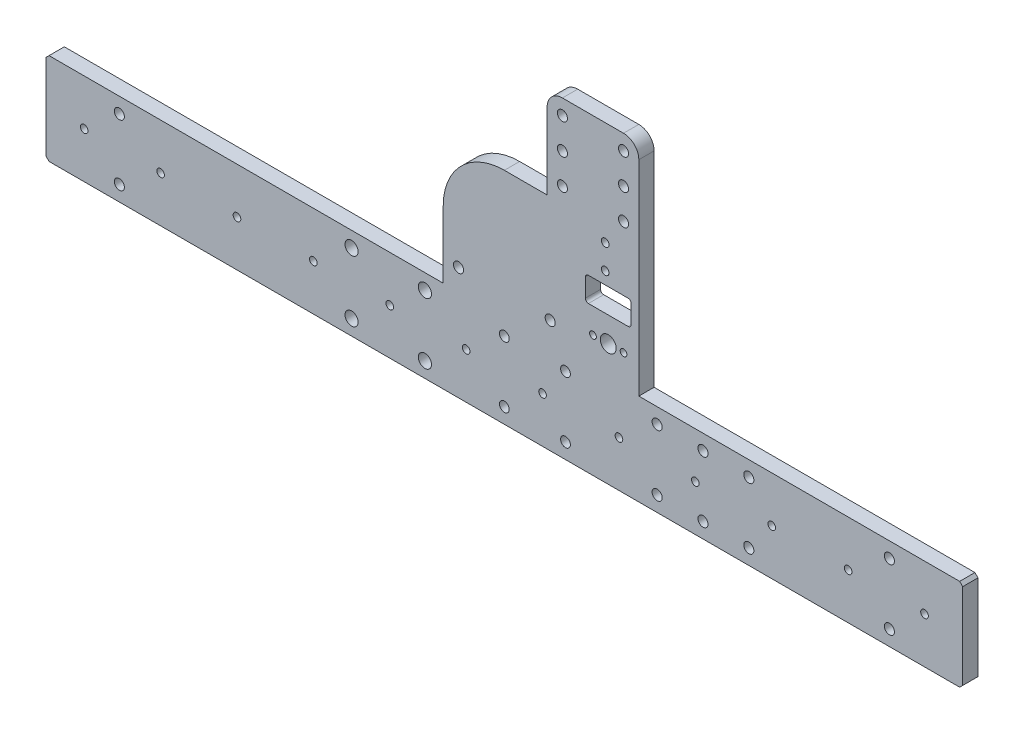
from build123d import *

# Parameters (mm, degrees)
SKETCH_1_W                  = 300
SKETCH_1_H                  = 30
EXTRUDE_1_DEPTH             = 5
CHAMFER_1_SIZE              = 1
HOLE_WIZARD_M3_1_D          = 3.2
M3X0_5_1_D                  = 2.5
M4X0_7_1_D                  = 3.3
M4X0_7_2_D                  = 3.3
PATTERN_LINEAR_1_COUNT      = 6
PATTERN_LINEAR_1_PITCH      = 25
PATTERN_LINEAR_1_COL_COUNT  = 7
PATTERN_LINEAR_1_COL_PITCH  = 25
EXTRUDE_3_DEPTH             = 5
SKETCH_13_R                 = 2.6
CUT_EXTRUDE_2_DEPTH         = 161.542829177
HOLE_WIZARD_M2_1_D          = 2.2
M4X0_7_3_D                  = 3.3
HOLE_WIZARD_M4_1_D          = 4.3
M3X0_5_2_D                  = 2.5
CUT_EXTRUDE_3_DEPTH         = 161.542829177
CUT_EXTRUDE_3_DEPTH_BACK    = 161.542829177
SKETCH_25_W                 = 15
SKETCH_25_H                 = 8
FILLET_1_R                  = 1
SKETCH_26_W                 = 30
SKETCH_26_H                 = 5
EXTRUDE_4_DEPTH             = 30
SKETCH_27_R                 = 1.65
CUT_EXTRUDE_4_DEPTH         = 174.476223155
PATTERN_LINEAR_2_COUNT      = 2
PATTERN_LINEAR_2_PITCH      = 20
PATTERN_LINEAR_2_COUNT_DIR2 = 3
PATTERN_LINEAR_2_PITCH_DIR2 = 10
FILLET_2_R                  = 5


with BuildPart() as part:
    # 草圖1 → 填料-伸長1 (new body)
    with BuildSketch(Plane.XY):
        Rectangle(SKETCH_1_W, SKETCH_1_H)
    extrude(amount=EXTRUDE_1_DEPTH)

    # 導角1
    chamfer_1_edges = [part.edges().sort_by_distance(p)[0] for p in [
        (150, -15, 2.5),
        (-150, -15, 2.5),
        (-150, 15, 2.5),
        (150, 15, 2.5),
    ]]
    chamfer(chamfer_1_edges, length=CHAMFER_1_SIZE)

    # M3 餘隙孔1 (through all)
    with Locations(Plane.XY.offset(5)):
        with Locations((20, -10), (20, 10), (0, -10), (0, 10)):
            Hole(HOLE_WIZARD_M3_1_D / 2)

    # M3x0.5 螺紋孔1 (through all)
    with Locations(Plane.XY.offset(5)):
        with Locations((-12.5, 0)):
            m3x0_5_1 = Hole(M3X0_5_1_D / 2)

    # M4x0.7 螺紋孔1 (through all)
    with Locations(Plane.XY.offset(5)):
        with Locations((80, 10), (50, -10), (50, 10), (80, -10), (65, 10), (65, -10)):
            Hole(M4X0_7_1_D / 2)

    # M4x0.7 螺紋孔2 (through all)
    with Locations(Plane.XY.offset(5)):
        with Locations((-126, 10), (-126, -10)):
            m4x0_7_2 = Hole(M4X0_7_2_D / 2)

    # 直線複製排列1: M3x0.5 螺紋孔1 ×6
    with Locations(*[(-i * PATTERN_LINEAR_1_PITCH, 0, 0) for i in range(1, PATTERN_LINEAR_1_COUNT)]):
        add(m3x0_5_1, mode=Mode.SUBTRACT)

    # 直線複製排列1 col: M3x0.5 螺紋孔1 ×7
    with Locations(*[(i * PATTERN_LINEAR_1_COL_PITCH, 0, 0) for i in range(1, PATTERN_LINEAR_1_COL_COUNT)]):
        add(m3x0_5_1, mode=Mode.SUBTRACT)

    # 鏡射1: M4x0.7 螺紋孔2 across plane
    add(m4x0_7_2.mirror(Plane(origin=(0, 0, 0), x_dir=(0, 0, 1), z_dir=(1, 0, 0))), mode=Mode.SUBTRACT)

    # 草圖16 → 填料-伸長3 (add, through all)
    with BuildSketch(Plane.XY):
        with BuildLine():
            Line((-20, 15), (44, 15))
            Line((44, 15), (44, 57))
            Line((44, 57), (0, 57))
            ThreePointArc((0, 57), (-14.142135624, 51.142135624), (-20, 37))
            Line((-20, 37), (-20, 15))
        make_face()
    extrude(amount=EXTRUDE_3_DEPTH)

    # 草圖13 → 除料-伸長2 (cut, through all)
    with BuildSketch(Plane.XY):
        with Locations(Location((34, 24.8, 0), (0, 0, 180))):
            Circle(SKETCH_13_R)
    extrude(amount=CUT_EXTRUDE_2_DEPTH, mode=Mode.SUBTRACT)

    # M2 餘隙孔1 (through all)
    with Locations(Plane.XY.offset(5)):
        with Locations((29, 24.8), (39, 24.8)):
            Hole(HOLE_WIZARD_M2_1_D / 2)

    # M4x0.7 螺紋孔3 (through all)
    with Locations(Plane.XY.offset(5)):
        with Locations((15, 22), (-15, 22)):
            Hole(M4X0_7_3_D / 2)

    # M4 餘隙孔1 (through all)
    with Locations(Plane.XY.offset(5)):
        with Locations((-26, -10), (-26, 10), (-50, -10), (-50, 10)):
            Hole(HOLE_WIZARD_M4_1_D / 2)

    # M3x0.5 螺紋孔2 (through all)
    with Locations(Plane.XY.offset(5)):
        with Locations((33, 53), (33, 45)):
            Hole(M3X0_5_2_D / 2)

    # 草圖25 → 除料-伸長3 (cut, two sides: drawn at the far end of the back side and taken through both)
    with BuildSketch(Plane.XY.offset(5).offset(-CUT_EXTRUDE_3_DEPTH_BACK)):
        with Locations((34, 37)):
            Rectangle(SKETCH_25_W, SKETCH_25_H)
    extrude(amount=CUT_EXTRUDE_3_DEPTH + CUT_EXTRUDE_3_DEPTH_BACK, mode=Mode.SUBTRACT)

    # 圓角1
    fillet_1_edges = [part.edges().sort_by_distance(p)[0] for p in [
        (41.5, 41, 2.5),
        (41.5, 33, 2.5),
        (26.5, 33, 2.5),
        (26.5, 41, 2.5),
    ]]
    fillet(fillet_1_edges, radius=FILLET_1_R)

    # 草圖26 → 填料-伸長4 (add)
    with BuildSketch(Plane(origin=(0, 57, 0), x_dir=(1, 0, 0), z_dir=(0, 1, 0))):
        with Locations((29, -2.5)):
            Rectangle(SKETCH_26_W, SKETCH_26_H)
    extrude(amount=EXTRUDE_4_DEPTH)

    # 草圖27 → 除料-伸長4 (cut, through all)
    with BuildSketch(Plane.XY.offset(5)):
        with Locations((19, 82)):
            Circle(SKETCH_27_R)
    cut_extrude_4 = extrude(amount=-CUT_EXTRUDE_4_DEPTH, mode=Mode.SUBTRACT)

    # 直線複製排列2: Cut-Extrude 4 2 × 3
    with Locations(*[(i * PATTERN_LINEAR_2_PITCH, -j * PATTERN_LINEAR_2_PITCH_DIR2, 0) for i in range(PATTERN_LINEAR_2_COUNT) for j in range(PATTERN_LINEAR_2_COUNT_DIR2) if (i, j) != (0, 0)]):
        add(cut_extrude_4, mode=Mode.SUBTRACT)

    # 圓角2
    fillet_2_edges = [part.edges().sort_by_distance(p)[0] for p in [
        (44, 87, 2.5),
        (14, 87, 2.5),
    ]]
    fillet(fillet_2_edges, radius=FILLET_2_R)


solid = part.part
